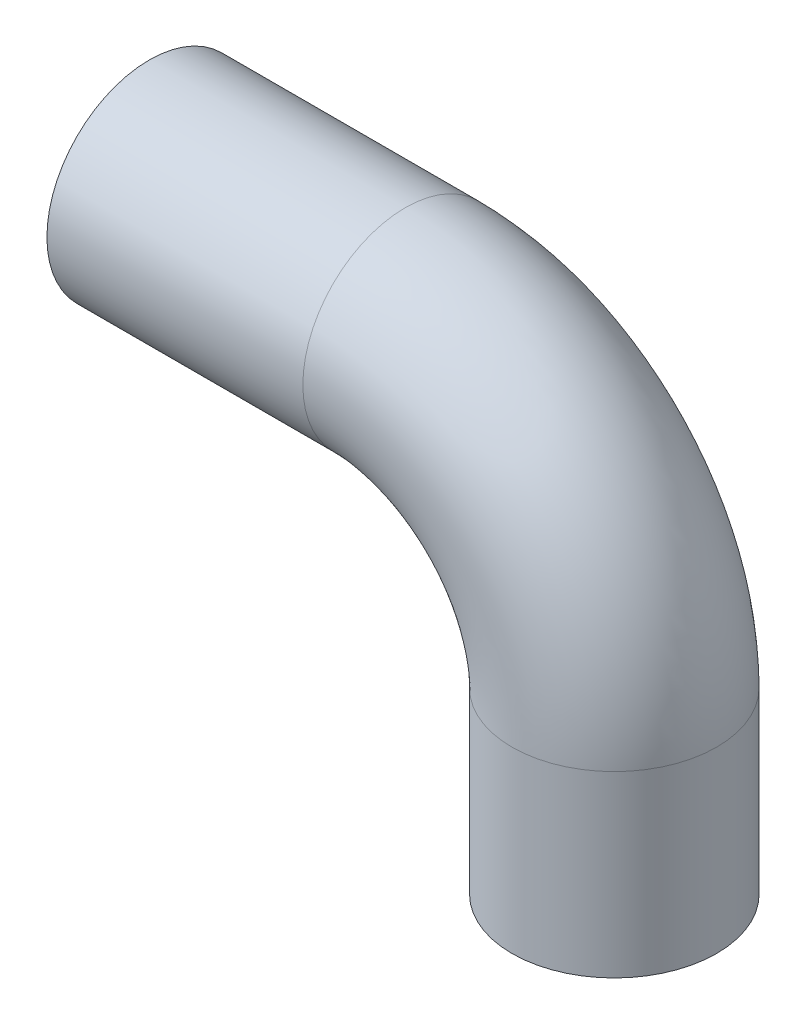
from build123d import *

# Parameters (mm, degrees)
SKETCH_2_R   = 2
SKETCH_2_R_2 = 1.25


with BuildPart() as part:
    # 扫描1: sweep along a path in 草图1
    with BuildLine(Plane.XY) as sweep_1_path:
        Line((0, 0), (5, 0))
        ThreePointArc((5, 0), (7.888427708, -1.196425931), (9.084853638, -4.084853638))
        Line((9.084853638, -4.084853638), (9.084853638, -7.576530612))
    # 草图2 → 扫描1 (sweep)
    with BuildSketch(Plane(origin=(0, 0, 0), x_dir=(0, 0, -1), z_dir=(1, 0, 0))):
        Circle(SKETCH_2_R)
        Circle(SKETCH_2_R_2, mode=Mode.SUBTRACT)
    sweep(path=sweep_1_path.line)


solid = part.part
